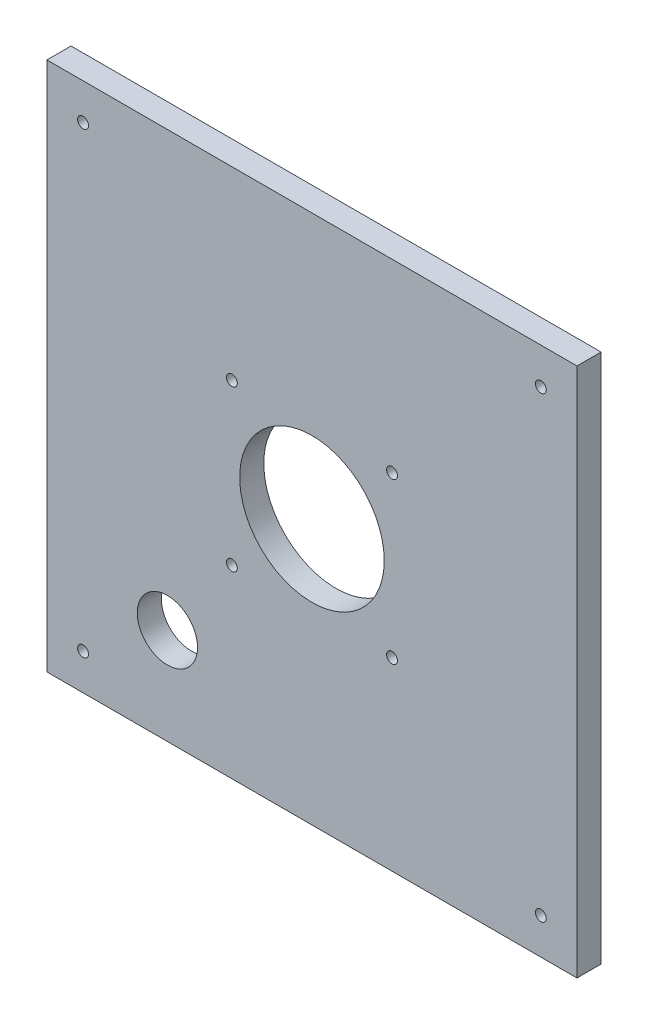
from build123d import *

# Parameters (mm, degrees)
SK_PLACA_W                         = 220
SK_PLACA_H                         = 220
PLACA_DEPTH                        = 10
SK_PASO_CABLES_R                   = 30
PASO_CABLES_DEPTH                  = 10
SK_PASANTES_M4_PEDESTAL_R          = 2.25
PASANTES_M4_PEDESTAL_DEPTH         = 10
SK_CAJAS_M4_INFERIORES_R           = 4
CAJAS_M4_INFERIORES_DEPTH          = 4.5
SK_PASANTES_M4_SEPARADORES_CAJA_R  = 2.25
PASANTES_M4_SEPARADORES_CAJA_DEPTH = 10
SK_PASO_CABLES_CAJA_R              = 12.5
PASO_CABLES_CAJA_DEPTH             = 10


with BuildPart() as part:
    # Sk_Placa → Placa (new body)
    with BuildSketch(Plane.XY):
        Rectangle(SK_PLACA_W, SK_PLACA_H)
    extrude(amount=PLACA_DEPTH)

    # Sk_Paso_cables → Paso_cables (cut)
    with BuildSketch(Plane.XY):
        Circle(SK_PASO_CABLES_R)
    extrude(amount=PASO_CABLES_DEPTH, mode=Mode.SUBTRACT)

    # Sk_Pasantes_M4_pedestal → Pasantes_M4_pedestal (cut)
    with BuildSketch(Plane.XY):
        with Locations((33.234018716, 33.234018716)):
            Circle(SK_PASANTES_M4_PEDESTAL_R)
        with Locations((-33.234018716, 33.234018716)):
            Circle(SK_PASANTES_M4_PEDESTAL_R)
        with Locations((-33.234018716, -33.234018716)):
            Circle(SK_PASANTES_M4_PEDESTAL_R)
        with Locations((33.234018716, -33.234018716)):
            Circle(SK_PASANTES_M4_PEDESTAL_R)
    extrude(amount=PASANTES_M4_PEDESTAL_DEPTH, mode=Mode.SUBTRACT)

    # Sk_Cajas_M4_inferiores → Cajas_M4_inferiores (cut)
    with BuildSketch(Plane.XY):
        with Locations((33.234018716, 33.234018716)):
            Circle(SK_CAJAS_M4_INFERIORES_R)
        with Locations((-33.234018716, 33.234018716)):
            Circle(SK_CAJAS_M4_INFERIORES_R)
        with Locations((-33.234018716, -33.234018716)):
            Circle(SK_CAJAS_M4_INFERIORES_R)
        with Locations((33.234018716, -33.234018716)):
            Circle(SK_CAJAS_M4_INFERIORES_R)
    extrude(amount=CAJAS_M4_INFERIORES_DEPTH, mode=Mode.SUBTRACT)

    # Sk_Pasantes_M4_separadores_caja → Pasantes_M4_separadores_caja (cut)
    with BuildSketch(Plane.XY):
        with Locations((-95, -95)):
            Circle(SK_PASANTES_M4_SEPARADORES_CAJA_R)
        with Locations((-95, 95)):
            Circle(SK_PASANTES_M4_SEPARADORES_CAJA_R)
        with Locations((95, -95)):
            Circle(SK_PASANTES_M4_SEPARADORES_CAJA_R)
        with Locations((95, 95)):
            Circle(SK_PASANTES_M4_SEPARADORES_CAJA_R)
    extrude(amount=PASANTES_M4_SEPARADORES_CAJA_DEPTH, mode=Mode.SUBTRACT)

    # Sk_Paso_cables_caja → Paso_cables_caja (cut)
    with BuildSketch(Plane.XY):
        with Locations((-60, -70)):
            Circle(SK_PASO_CABLES_CAJA_R)
    extrude(amount=PASO_CABLES_CAJA_DEPTH, mode=Mode.SUBTRACT)


solid = part.part
